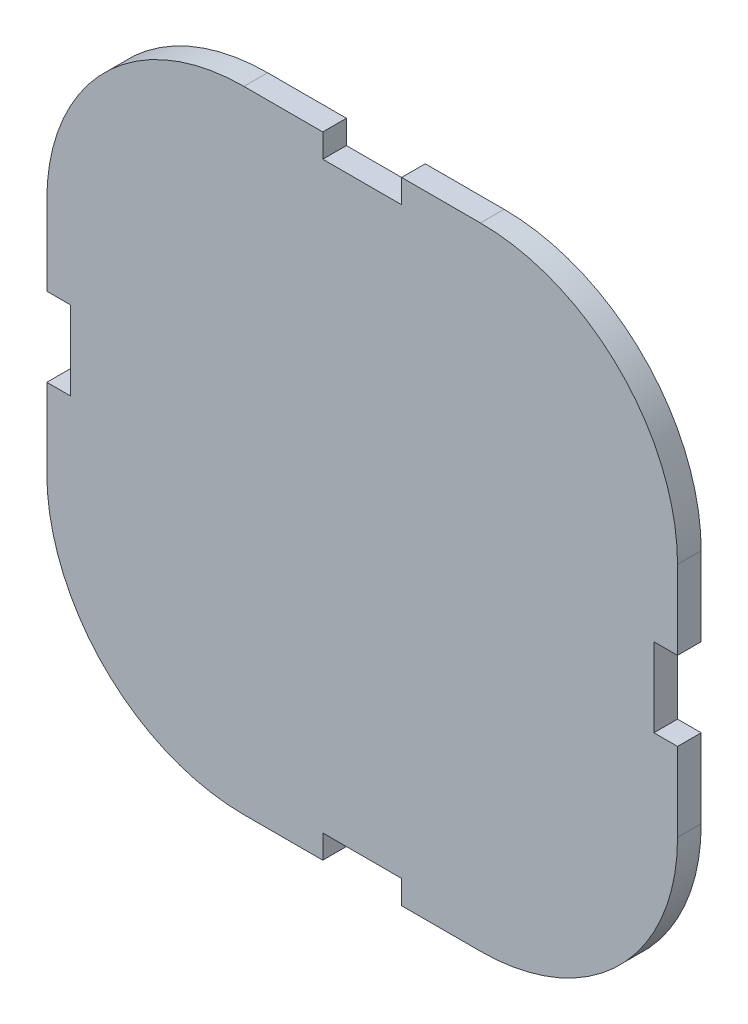
from build123d import *

# Parameters (mm, degrees)
EXTRUDE_1_DEPTH = 3


with BuildPart() as part:
    # 草圖1 → 填料-伸長1 (new body)
    with BuildSketch(Plane.XY):
        with BuildLine():
            Line((-5, 40), (-15, 40))
            ThreePointArc((-15, 40), (-32.67766953, 32.67766953), (-40, 15))
            Line((-40, 15), (-40, 5))
            Line((-40, 5), (-37, 5))
            Line((-37, 5), (-37, -5))
            Line((-37, -5), (-40, -5))
            Line((-40, -5), (-40, -15))
            ThreePointArc((-40, -15), (-32.67766953, -32.67766953), (-15, -40))
            Line((-15, -40), (-5, -40))
            Line((-5, -40), (-5, -37))
            Line((-5, -37), (5, -37))
            Line((5, -37), (5, -40))
            Line((5, -40), (15, -40))
            ThreePointArc((15, -40), (32.67766953, -32.67766953), (40, -15))
            Line((40, -15), (40, -5))
            Line((40, -5), (37, -5))
            Line((37, -5), (37, 5))
            Line((37, 5), (40, 5))
            Line((40, 5), (40, 15))
            ThreePointArc((40, 15), (32.67766953, 32.67766953), (15, 40))
            Line((15, 40), (5, 40))
            Line((5, 40), (5, 37))
            Line((5, 37), (-5, 37))
            Line((-5, 37), (-5, 40))
        make_face()
    extrude(amount=EXTRUDE_1_DEPTH)


solid = part.part
